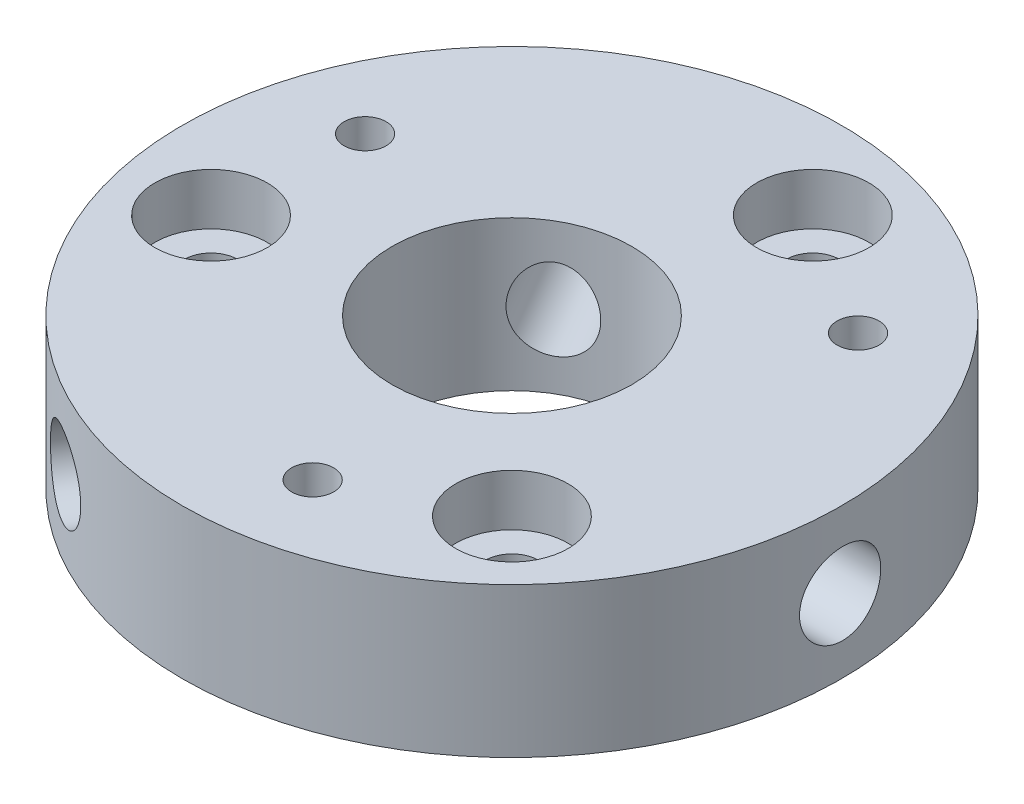
from build123d import *

# Parameters (mm, degrees)
SKETCH1_R                                      = 13.97
BOSS_EXTRUDE1_DEPTH                            = 6.35
CBORE_FOR_2_SOCKET_HEAD_CAP_SCREW1_D           = 2.2606
CBORE_FOR_2_SOCKET_HEAD_CAP_SCREW1_CBORE_D     = 4.7625
CBORE_FOR_2_SOCKET_HEAD_CAP_SCREW1_CBORE_DEPTH = 2.1844
CIRPATTERN1_COUNT                              = 3
CIRPATTERN2_COUNT                              = 3
CIRPATTERN3_COUNT                              = 3
CUT_EXTRUDE2_REACH                             = 22.752
SKETCH16_R                                     = 5.08


with BuildPart() as part:
    # Sketch1 → Boss-Extrude1 (new body)
    with BuildSketch(Plane(origin=(0, 0, 0), x_dir=(1, 0, 0), z_dir=(0, 1, 0))):
        with Locations(Location((0, 0, 0), (0, 0, 270))):
            Circle(SKETCH1_R)
    extrude(amount=BOSS_EXTRUDE1_DEPTH)

    # CBORE for #2 Socket Head Cap Screw1 (through all)
    with Locations(Plane(origin=(0, 6.35, 0), x_dir=(1, 0, 0), z_dir=(0, 1, 0))):
        with Locations((7.363810019, -7.363810019)):
            cbore_for_2_socket_head_cap_screw1 = CounterBoreHole(CBORE_FOR_2_SOCKET_HEAD_CAP_SCREW1_D / 2, CBORE_FOR_2_SOCKET_HEAD_CAP_SCREW1_CBORE_D / 2, CBORE_FOR_2_SOCKET_HEAD_CAP_SCREW1_CBORE_DEPTH)

    # CirPattern1: CBORE for #2 Socket Head Cap Screw1 ×3 about axis
    cirpattern1_axis = Axis((0, 0, 0), (0, 1, 0))
    for i in range(1, CIRPATTERN1_COUNT):
        add(cbore_for_2_socket_head_cap_screw1.rotate(cirpattern1_axis, i * 360 / CIRPATTERN1_COUNT), mode=Mode.SUBTRACT)

    # Sketch10 → Tap Drill for #2-56 Tap2 (revolve, cut)
    with BuildSketch(Plane(origin=(7.977586831, 6.35, -6.693990167), x_dir=(0, 0, 1), z_dir=(1, 0, 0))):
        Polygon((0, 0), (0, 4.59816509), (0.889, 4.064), (0.889, 0), align=None)
    tap_drill_for_2_56_tap2 = revolve(axis=Axis((7.977586831, 12.7, -6.693990167), (0, -1, 0)), mode=Mode.SUBTRACT)

    # CirPattern2: Tap Drill for #2-56 Tap2 ×3 about axis
    cirpattern2_axis = Axis((0, 0, 0), (0, 1, 0))
    for i in range(1, CIRPATTERN2_COUNT):
        add(tap_drill_for_2_56_tap2.rotate(cirpattern2_axis, i * 360 / CIRPATTERN2_COUNT), mode=Mode.SUBTRACT)

    # Sketch15 → Tap Drill for #8-32 Tap2 (revolve, cut)
    with BuildSketch(Plane(origin=(-6.942501454, 3.105629072, 12.122812114), x_dir=(0.8677746681735182, 0, 0.4969578707258195), z_dir=(0, 1, 0))):
        Polygon((0, 0), (0, 10.339292883), (1.7272, 8.89), (1.7272, 0), align=None)
    tap_drill_for_8_32_tap2 = revolve(axis=Axis((-10.098183933, 3.105629072, 17.633181257), (0.4969578707258195, 0, -0.8677746681735182)), mode=Mode.SUBTRACT)

    # CirPattern3: Tap Drill for #8-32 Tap2 ×3 about axis
    cirpattern3_axis = Axis((0, 6.35, 0), (0, -1, 0))
    for i in range(1, CIRPATTERN3_COUNT):
        add(tap_drill_for_8_32_tap2.rotate(cirpattern3_axis, i * 360 / CIRPATTERN3_COUNT), mode=Mode.SUBTRACT)

    # Sketch16 → Cut-Extrude2 (cut, up to next)
    with BuildSketch(Plane(origin=(0, 6.35, 0), x_dir=(1, 0, 0), z_dir=(0, 1, 0)), mode=Mode.PRIVATE) as cut_extrude2_sk1:
        with Locations(Location((0, 0, 0), (0, 0, 270))):
            Circle(SKETCH16_R)
    cut_extrude2_tool1 = extrude(cut_extrude2_sk1.sketch, amount=-CUT_EXTRUDE2_REACH, mode=Mode.PRIVATE) & part.part
    add(cut_extrude2_tool1.solids().sort_by_distance((0, 6.35, 0))[0], mode=Mode.SUBTRACT)


solid = part.part
